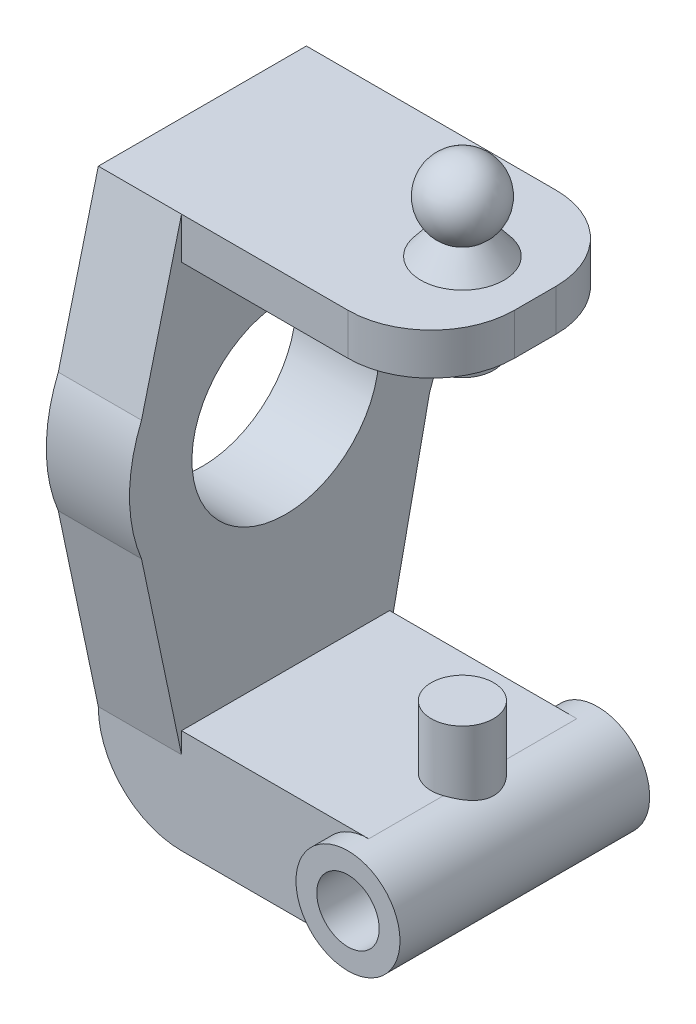
from build123d import *

# Parameters (mm, degrees)
SKETCH_1_R          = 1.5
EXTRUDE_1_DEPTH     = 10
EXTRUDE_START       = 1
SKETCH_2_R          = 2.5
SKETCH_2_R_2        = 1.5
EXTRUDE_2_DEPTH     = 1
SKETCH_3_R          = 2.5
SKETCH_3_R_2        = 1.5
EXTRUDE_3_DEPTH     = 1
FILLET_1_R          = 4
SKETCH_6_R          = 1.5
EXTRUDE_4_DEPTH     = 2
SKETCH_7_R          = 1.5
EXTRUDE_5_DEPTH     = 1
EXTRUDE_START_2     = 2
SKETCH_8_R          = 1.5
EXTRUDE_6_DEPTH     = 2
EXTRUDE_7_DEPTH     = 4
SKETCH_10_R         = 4.5
CUT_EXTRUDE_1_DEPTH = 4


with BuildPart() as part:
    # 草图1 → 凸台-拉伸1 (new body)
    with BuildSketch(Plane.XY):
        with BuildLine():
            Line((4, 0), (13, 0))
            ThreePointArc((13, 0), (15.5, 2.5), (13, 5))
            Line((13, 5), (4, 5))
            Line((4, 5), (4, 24.5))
            Line((4, 24.5), (16, 24.5))
            Line((16, 24.5), (16, 26.5))
            Line((16, 26.5), (0, 26.5))
            Line((0, 26.5), (0, 4))
            ThreePointArc((0, 4), (1.171572875, 1.171572875), (4, 0))
        make_face()
        with Locations((13, 2.5)):
            Circle(SKETCH_1_R, mode=Mode.SUBTRACT)
    extrude(amount=EXTRUDE_1_DEPTH)

    # 草图2 → 凸台-拉伸2 (add)
    with BuildSketch(Plane(origin=(0, 0, 0), x_dir=(-1, 0, 0), z_dir=(0, 0, -1)).offset(EXTRUDE_START)):
        with Locations((-13, 2.5)):
            Circle(SKETCH_2_R)
        with Locations((-13, 2.5)):
            Circle(SKETCH_2_R_2, mode=Mode.SUBTRACT)
    extrude(amount=-EXTRUDE_2_DEPTH)

    # 草图3 → 凸台-拉伸3 (add)
    with BuildSketch(Plane.XY.offset(10)):
        with Locations(Location((13, 2.5, 0), (0, 0, 180))):
            Circle(SKETCH_3_R)
        with Locations(Location((13, 2.5, 0), (0, 0, 180))):
            Circle(SKETCH_3_R_2, mode=Mode.SUBTRACT)
    extrude(amount=EXTRUDE_3_DEPTH)

    # 圆角1
    fillet_1_edges = [part.edges().sort_by_distance(p)[0] for p in [
        (16, 25.5, 10),
        (16, 25.5, 0),
    ]]
    fillet(fillet_1_edges, radius=FILLET_1_R)

    # 草图6 → 凸台-拉伸4 (add)
    with BuildSketch(Plane.XZ.offset(-24.5)):
        with Locations(Location((12.5, 5, 0), (0, 0, 180))):
            Circle(SKETCH_6_R)
    extrude(amount=EXTRUDE_4_DEPTH)

    # 草图7 → 凸台-拉伸5 (add, symmetric)
    with BuildSketch(Plane(origin=(0, 5, 0), x_dir=(1, 0, 0), z_dir=(0, 1, 0))):
        with Locations(Location((12.5, -5, 0), (0, 0, 180))):
            Circle(SKETCH_7_R)
    extrude(amount=EXTRUDE_5_DEPTH, both=True)

    # 草图8 → 凸台-拉伸6 (add)
    with BuildSketch(Plane(origin=(0, 6, 0), x_dir=(1, 0, 0), z_dir=(0, 1, 0)).offset(EXTRUDE_START_2)):
        with Locations(Location((12.5, -5, 0), (0, 0, 180))):
            Circle(SKETCH_8_R)
    extrude(amount=-EXTRUDE_6_DEPTH)

    # 草图9 → 凸台-拉伸7 (add)
    with BuildSketch(Plane.ZY):
        with BuildLine():
            Line((10, 26.5), (11.923076923, 18.884615385))
            ThreePointArc((11.923076923, 18.884615385), (12.5, 16), (11.923076923, 13.115384615))
            Line((11.923076923, 13.115384615), (10, 4))
            Line((10, 4), (0, 4))
            Line((0, 4), (-1.923076923, 13.115384615))
            ThreePointArc((-1.923076923, 13.115384615), (-2.5, 16), (-1.923076923, 18.884615385))
            Line((-1.923076923, 18.884615385), (0, 26.5))
            Line((0, 26.5), (10, 26.5))
        make_face()
    extrude(amount=-EXTRUDE_7_DEPTH)

    # 草图10 → 切除-拉伸1 (cut)
    with BuildSketch(Plane.ZY):
        with Locations(Location((5, 16, 0), (0, 0, 270))):
            Circle(SKETCH_10_R)
    extrude(amount=-CUT_EXTRUDE_1_DEPTH, mode=Mode.SUBTRACT)

    # 草图11 → 旋转1 (revolve)
    with BuildSketch(Plane.ZY.offset(-12.5), mode=Mode.PRIVATE) as revolve_1_sk:
        with BuildLine():
            Line((5, 26.5), (3, 26.5))
            Line((3, 26.5), (3.913470068, 27.641837585))
            ThreePointArc((3.913470068, 27.641837585), (3.358750534, 29.575719227), (5, 30.739296536))
            Line((5, 30.739296536), (5, 29))
            Line((5, 29), (5, 26.5))
        make_face()
    revolve(revolve_1_sk.sketch.rotate(Axis((12.5, 29, 5), (0, 1, 0)), 340.52877936), axis=Axis((12.5, 29, 5), (0, 1, 0)))


solid = part.part
